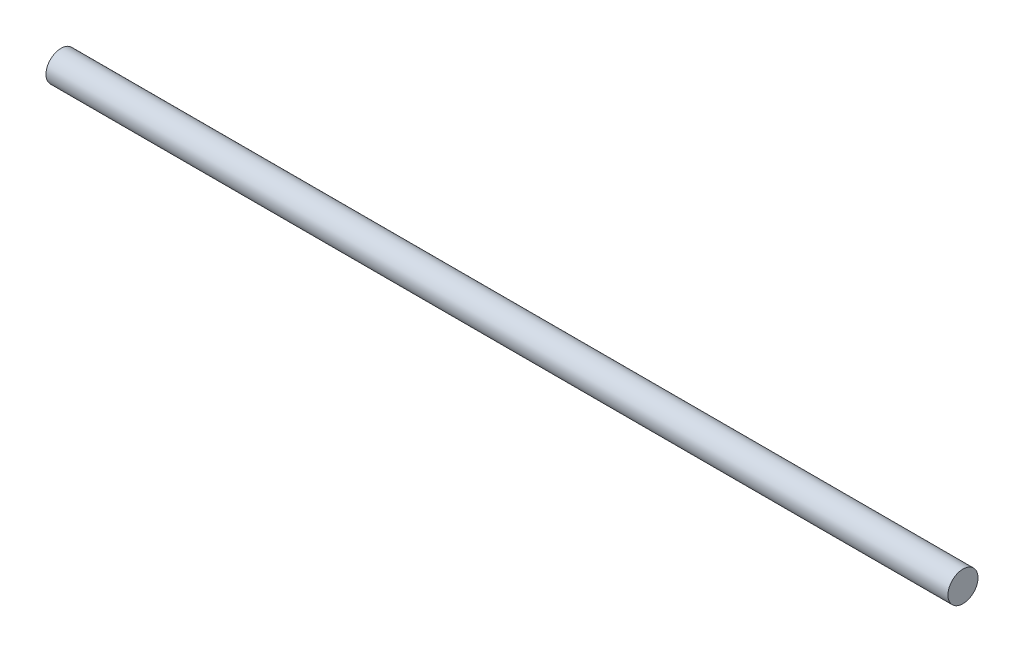
from build123d import *

# Parameters (mm, degrees)
SKETCH_1_R      = 2
EXTRUDE_1_DEPTH = 120


with BuildPart() as part:
    # 草图1 → 凸台-拉伸1 (new body)
    with BuildSketch(Plane(origin=(0, 0, 0), x_dir=(0, 0, -1), z_dir=(1, 0, 0))):
        Circle(SKETCH_1_R)
    extrude(amount=EXTRUDE_1_DEPTH)


solid = part.part
